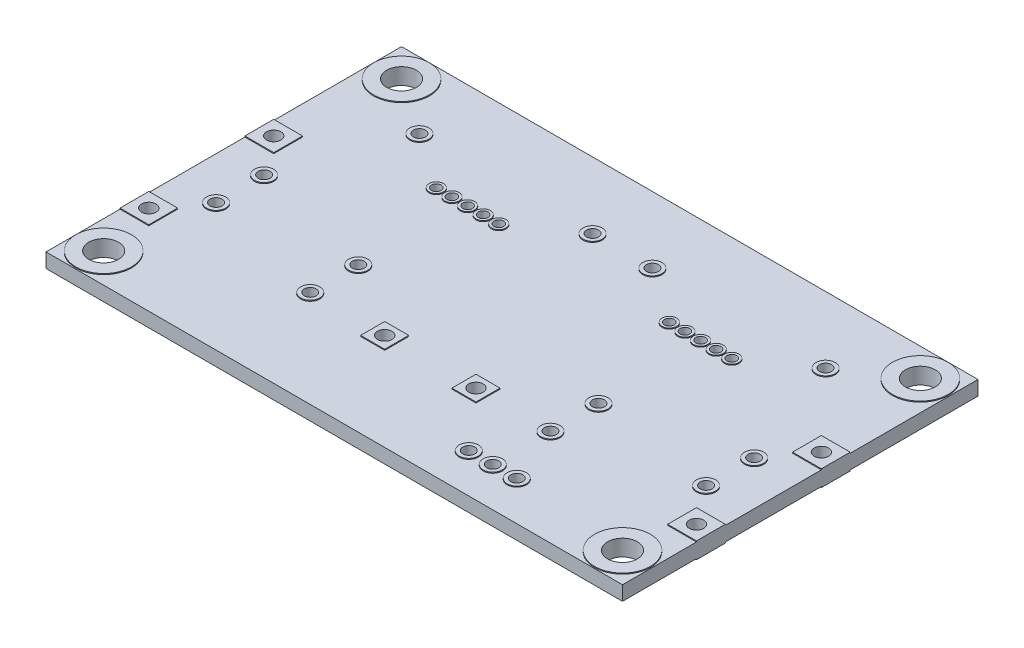
from build123d import *

# Parameters (mm, degrees)
BOSS_EXTRUDE1_DEPTH = 0.75
SKETCH2_R           = 1.5499999999999976
SKETCH2_R_2         = 0.6250000000000023
SKETCH2_R_3         = 0.6249999999999998
SKETCH2_R_4         = 0.49999999999999917
SKETCH2_R_5         = 0.5000000000000009
SKETCH2_R_6         = 0.49999999999999895
SKETCH2_R_7         = 0.750000000000002
SKETCH2_R_8         = 0.7500000000000021
SKETCH2_R_9         = 0.6249999999999986
SKETCH2_R_10        = 0.6250000000000007
SKETCH2_R_11        = 0.6250000000000004
SKETCH2_R_12        = 0.7499999999999996
CUT_EXTRUDE1_DEPTH  = 1.5
BOSS_EXTRUDE2_START = 0.1
SKETCH3_R           = 2.9
SKETCH3_R_2         = 1.5499999999999976
SKETCH3_R_3         = 0.7500000000000021
SKETCH3_R_4         = 0.49999999999999917
SKETCH3_R_5         = 0.7500000000000004
SKETCH3_R_6         = 0.5000000000000009
SKETCH3_R_7         = 0.5000000000000026
SKETCH3_R_8         = 0.49999999999999895
SKETCH3_R_9         = 1.0000000000000016
SKETCH3_R_10        = 0.6249999999999987
SKETCH3_R_11        = 1.0000000000000013
SKETCH3_R_12        = 0.6250000000000023
SKETCH3_R_13        = 1.0000000000000018
SKETCH3_R_14        = 1
SKETCH3_R_15        = 0.6250000000000007
SKETCH3_R_16        = 0.6250000000000004
SKETCH3_R_17        = 0.9999999999999996
SKETCH3_W           = 3.0000000000000107
SKETCH3_H           = 3.000000000000025
SKETCH3_H_2         = 3.0000000000000204
SKETCH3_R_18        = 0.7499999999999996
BOSS_EXTRUDE2_DEPTH = 0.1


with BuildPart() as part:
    # Sketch1 → Boss-Extrude1 (new, symmetric)
    with BuildSketch(Plane(origin=(0, 0, 0), x_dir=(1, 0, 0), z_dir=(0, 1, 0))):
        Polygon((-30, 18.499999999999996), (30, 18.499999999999996), (30.000000000000007, -18.500000000000004), (-30, -18.500000000000004), align=None)
    extrude(amount=BOSS_EXTRUDE1_DEPTH, both=True)

    # Sketch2 → Cut-Extrude1 (cut)
    with BuildSketch(Plane.XZ.offset(0.75)):
        with Locations(Location((-27.000000000000004, 15.49999999999999, 0), (0, 0, 270))):
            Circle(SKETCH2_R)
        with Locations(Location((-26.999999999999996, -15.5, 0), (0, 0, 270))):
            Circle(SKETCH2_R)
        with Locations(Location((26.999999999999996, 15.5, 0), (0, 0, 270))):
            Circle(SKETCH2_R)
        with Locations(Location((26.999999999999996, -15.5, 0), (0, 0, 270))):
            Circle(SKETCH2_R)
        with Locations(Location((21.1375, -11.499999999999996, 0), (0, 0, 270))):
            Circle(SKETCH2_R_2)
        with Locations(Location((3.1125, -11.499999999999996, 0), (0, 0, 270))):
            Circle(SKETCH2_R_3)
        with Locations(Location((-3.1125, -11.499999999999996, 0), (0, 0, 270))):
            Circle(SKETCH2_R_3)
        with Locations(Location((-21.1375, -11.499999999999996, 0), (0, 0, 270))):
            Circle(SKETCH2_R_2)
        with Locations(Location((15.375, -7.4999999999999964, 0), (0, 0, 270))):
            Circle(SKETCH2_R_4)
        with Locations(Location((8.875000000000002, -7.499999999999997, 0), (0, 0, 270))):
            Circle(SKETCH2_R_5)
        with Locations(Location((12.125, -7.499999999999997, 0), (0, 0, 270))):
            Circle(SKETCH2_R_5)
        with Locations(Location((10.5, -7.499999999999997, 0), (0, 0, 270))):
            Circle(SKETCH2_R_5)
        with Locations(Location((13.75, -7.499999999999997, 0), (0, 0, 270))):
            Circle(SKETCH2_R_5)
        with Locations(Location((-13.75, -7.499999999999997, 0), (0, 0, 90))):
            Circle(SKETCH2_R_5)
        with Locations(Location((-10.5, -7.499999999999997, 0), (0, 0, 90))):
            Circle(SKETCH2_R_5)
        with Locations(Location((-12.125, -7.499999999999997, 0), (0, 0, 90))):
            Circle(SKETCH2_R_5)
        with Locations(Location((-8.875000000000002, -7.499999999999997, 0), (0, 0, 90))):
            Circle(SKETCH2_R_5)
        with Locations(Location((-15.375, -7.4999999999999964, 0), (0, 0, 90))):
            Circle(SKETCH2_R_6)
        with Locations(Location((-28.499999999999996, -3.699999999999995, 0), (0, 0, 270))):
            Circle(SKETCH2_R_7)
        with Locations(Location((-28.499999999999996, 9.300000000000004, 0), (0, 0, 270))):
            Circle(SKETCH2_R_8)
        with Locations(Location((28.499999999999996, 9.300000000000004, 0), (0, 0, 90))):
            Circle(SKETCH2_R_8)
        with Locations(Location((28.499999999999996, -3.699999999999995, 0), (0, 0, 90))):
            Circle(SKETCH2_R_7)
        with Locations(Location((-25.5, 0.30000000000000515, 0), (0, 0, 270))):
            Circle(SKETCH2_R_9)
        with Locations(Location((-25.5, 5.300000000000005, 0), (0, 0, 270))):
            Circle(SKETCH2_R_2)
        with Locations(Location((25.5, 5.300000000000005, 0), (0, 0, 90))):
            Circle(SKETCH2_R_2)
        with Locations(Location((25.5, 0.30000000000000515, 0), (0, 0, 90))):
            Circle(SKETCH2_R_9)
        with Locations(Location((-12.5, 8.500000000000002, 0), (0, 0, 270))):
            Circle(SKETCH2_R_10)
        with Locations(Location((-12.5, 3.500000000000002, 0), (0, 0, 270))):
            Circle(SKETCH2_R_11)
        with Locations(Location((12.5, 8.500000000000002, 0), (0, 0, 90))):
            Circle(SKETCH2_R_10)
        with Locations(Location((12.5, 3.500000000000002, 0), (0, 0, 90))):
            Circle(SKETCH2_R_11)
        with Locations(Location((4.75, 8.500000000000002, 0), (0, 0, 270))):
            Circle(SKETCH2_R_12)
        with Locations(Location((-4.75, 8.500000000000002, 0), (0, 0, 270))):
            Circle(SKETCH2_R_12)
        with Locations(Location((15.000000000000007, 14.500000000000002, 0), (0, 0, 270))):
            Circle(SKETCH2_R_10)
        with Locations(Location((12.500000000000005, 14.500000000000002, 0), (0, 0, 270))):
            Circle(SKETCH2_R_10)
        with Locations(Location((10.000000000000005, 14.500000000000002, 0), (0, 0, 270))):
            Circle(SKETCH2_R_10)
    extrude(amount=-CUT_EXTRUDE1_DEPTH, mode=Mode.SUBTRACT)

    # Sketch3 → Boss-Extrude2 (add)
    # profile 1 of 35: a face of its own
    with BuildSketch(Plane.XZ.offset(0.75).offset(BOSS_EXTRUDE2_START)):
        with Locations(Location((26.999999999999996, 15.5, 0), (0, 0, 90))):
            Circle(SKETCH3_R)
        with Locations(Location((26.999999999999996, 15.5, 0), (0, 0, 270))):
            Circle(SKETCH3_R_2, mode=Mode.SUBTRACT)
    # profile 2 of 35: a face of its own
    with BuildSketch(Plane.XZ.offset(0.75).offset(BOSS_EXTRUDE2_START)):
        with Locations(Location((26.999999999999996, -15.5, 0), (0, 0, 90))):
            Circle(SKETCH3_R)
        with Locations(Location((26.999999999999996, -15.5, 0), (0, 0, 270))):
            Circle(SKETCH3_R_2, mode=Mode.SUBTRACT)
    # profile 3 of 35: a face of its own
    with BuildSketch(Plane.XZ.offset(0.75).offset(BOSS_EXTRUDE2_START)):
        with Locations(Location((-27.000000000000004, 15.49999999999999, 0), (0, 0, 90))):
            Circle(SKETCH3_R)
        with Locations(Location((-27.000000000000004, 15.49999999999999, 0), (0, 0, 270))):
            Circle(SKETCH3_R_2, mode=Mode.SUBTRACT)
    # profile 4 of 35: a face of its own
    with BuildSketch(Plane.XZ.offset(0.75).offset(BOSS_EXTRUDE2_START)):
        with Locations(Location((-26.999999999999996, -15.5, 0), (0, 0, 90))):
            Circle(SKETCH3_R)
        with Locations(Location((-26.999999999999996, -15.5, 0), (0, 0, 270))):
            Circle(SKETCH3_R_2, mode=Mode.SUBTRACT)
    # profile 5 of 35: a face of its own
    with BuildSketch(Plane.XZ.offset(0.75).offset(BOSS_EXTRUDE2_START)):
        with Locations(Location((15.375, -7.4999999999999964, 0), (0, 0, 90))):
            Circle(SKETCH3_R_3)
        with Locations(Location((15.375, -7.4999999999999964, 0), (0, 0, 270))):
            Circle(SKETCH3_R_4, mode=Mode.SUBTRACT)
    # profile 6 of 35: a face of its own
    with BuildSketch(Plane.XZ.offset(0.75).offset(BOSS_EXTRUDE2_START)):
        with Locations(Location((13.75, -7.499999999999997, 0), (0, 0, 90))):
            Circle(SKETCH3_R_5)
        with Locations(Location((13.75, -7.499999999999997, 0), (0, 0, 270))):
            Circle(SKETCH3_R_6, mode=Mode.SUBTRACT)
    # profile 7 of 35: a face of its own
    with BuildSketch(Plane.XZ.offset(0.75).offset(BOSS_EXTRUDE2_START)):
        with Locations(Location((12.125, -7.499999999999997, 0), (0, 0, 90))):
            Circle(SKETCH3_R_5)
        with Locations(Location((12.125, -7.499999999999997, 0), (0, 0, 270))):
            Circle(SKETCH3_R_6, mode=Mode.SUBTRACT)
    # profile 8 of 35: a face of its own
    with BuildSketch(Plane.XZ.offset(0.75).offset(BOSS_EXTRUDE2_START)):
        with Locations(Location((10.5, -7.499999999999997, 0), (0, 0, 90))):
            Circle(SKETCH3_R_5)
        with Locations(Location((10.5, -7.499999999999997, 0), (0, 0, 270))):
            Circle(SKETCH3_R_6, mode=Mode.SUBTRACT)
    # profile 9 of 35: a face of its own
    with BuildSketch(Plane.XZ.offset(0.75).offset(BOSS_EXTRUDE2_START)):
        with Locations(Location((8.875000000000002, -7.499999999999997, 0), (0, 0, 90))):
            Circle(SKETCH3_R_5)
        with Locations(Location((8.875000000000002, -7.499999999999997, 0), (0, 0, 270))):
            Circle(SKETCH3_R_6, mode=Mode.SUBTRACT)
    # profile 10 of 35: a face of its own
    with BuildSketch(Plane.XZ.offset(0.75).offset(BOSS_EXTRUDE2_START)):
        with Locations(Location((-8.875000000000002, -7.499999999999997, 0), (0, 0, 90))):
            Circle(SKETCH3_R_5)
        with Locations(Location((-8.875000000000002, -7.499999999999997, 0), (0, 0, 270))):
            Circle(SKETCH3_R_7, mode=Mode.SUBTRACT)
    # profile 11 of 35: a face of its own
    with BuildSketch(Plane.XZ.offset(0.75).offset(BOSS_EXTRUDE2_START)):
        with Locations(Location((-10.5, -7.499999999999997, 0), (0, 0, 90))):
            Circle(SKETCH3_R_3)
        with Locations(Location((-10.5, -7.499999999999997, 0), (0, 0, 270))):
            Circle(SKETCH3_R_6, mode=Mode.SUBTRACT)
    # profile 12 of 35: a face of its own
    with BuildSketch(Plane.XZ.offset(0.75).offset(BOSS_EXTRUDE2_START)):
        with Locations(Location((-12.125, -7.499999999999997, 0), (0, 0, 90))):
            Circle(SKETCH3_R_5)
        with Locations(Location((-12.125, -7.499999999999997, 0), (0, 0, 270))):
            Circle(SKETCH3_R_6, mode=Mode.SUBTRACT)
    # profile 13 of 35: a face of its own
    with BuildSketch(Plane.XZ.offset(0.75).offset(BOSS_EXTRUDE2_START)):
        with Locations(Location((-13.75, -7.499999999999997, 0), (0, 0, 90))):
            Circle(SKETCH3_R_3)
        with Locations(Location((-13.75, -7.499999999999997, 0), (0, 0, 270))):
            Circle(SKETCH3_R_6, mode=Mode.SUBTRACT)
    # profile 14 of 35: a face of its own
    with BuildSketch(Plane.XZ.offset(0.75).offset(BOSS_EXTRUDE2_START)):
        with Locations(Location((-15.375, -7.4999999999999964, 0), (0, 0, 90))):
            Circle(SKETCH3_R_5)
        with Locations(Location((-15.375, -7.4999999999999964, 0), (0, 0, 270))):
            Circle(SKETCH3_R_8, mode=Mode.SUBTRACT)
    # profile 15 of 35: a face of its own
    with BuildSketch(Plane.XZ.offset(0.75).offset(BOSS_EXTRUDE2_START)):
        with Locations(Location((25.5, 0.30000000000000515, 0), (0, 0, 90))):
            Circle(SKETCH3_R_9)
        with Locations(Location((25.5, 0.30000000000000515, 0), (0, 0, 270))):
            Circle(SKETCH3_R_10, mode=Mode.SUBTRACT)
    # profile 16 of 35: a face of its own
    with BuildSketch(Plane.XZ.offset(0.75).offset(BOSS_EXTRUDE2_START)):
        with Locations(Location((25.5, 5.300000000000005, 0), (0, 0, 90))):
            Circle(SKETCH3_R_11)
        with Locations(Location((25.5, 5.300000000000005, 0), (0, 0, 270))):
            Circle(SKETCH3_R_12, mode=Mode.SUBTRACT)
    # profile 17 of 35: a face of its own
    with BuildSketch(Plane.XZ.offset(0.75).offset(BOSS_EXTRUDE2_START)):
        with Locations(Location((21.1375, -11.499999999999996, 0), (0, 0, 90))):
            Circle(SKETCH3_R_13)
        with Locations(Location((21.1375, -11.499999999999996, 0), (0, 0, 270))):
            Circle(SKETCH3_R_12, mode=Mode.SUBTRACT)
    # profile 18 of 35: a face of its own
    with BuildSketch(Plane.XZ.offset(0.75).offset(BOSS_EXTRUDE2_START)):
        with Locations(Location((3.1125, -11.499999999999996, 0), (0, 0, 90))):
            Circle(SKETCH3_R_14)
        with Locations(Location((3.1125, -11.499999999999996, 0), (0, 0, 270))):
            Circle(SKETCH3_R_15, mode=Mode.SUBTRACT)
    # profile 19 of 35: a face of its own
    with BuildSketch(Plane.XZ.offset(0.75).offset(BOSS_EXTRUDE2_START)):
        with Locations(Location((-3.1125, -11.49999999999999, 0), (0, 0, 90))):
            Circle(SKETCH3_R_14)
        with Locations(Location((-3.1125, -11.49999999999999, 0), (0, 0, 90))):
            Circle(SKETCH3_R_15, mode=Mode.SUBTRACT)
    # profile 20 of 35: a face of its own
    with BuildSketch(Plane.XZ.offset(0.75).offset(BOSS_EXTRUDE2_START)):
        with Locations(Location((-21.1375, -11.500000000000002, 0), (0, 0, 90))):
            Circle(SKETCH3_R_13)
        with Locations(Location((-21.1375, -11.500000000000002, 0), (0, 0, 90))):
            Circle(SKETCH3_R_12, mode=Mode.SUBTRACT)
    # profile 21 of 35: a face of its own
    with BuildSketch(Plane.XZ.offset(0.75).offset(BOSS_EXTRUDE2_START)):
        with Locations(Location((-25.5, 5.300000000000002, 0), (0, 0, 90))):
            Circle(SKETCH3_R_11)
        with Locations(Location((-25.5, 5.300000000000002, 0), (0, 0, 90))):
            Circle(SKETCH3_R_12, mode=Mode.SUBTRACT)
    # profile 22 of 35: a face of its own
    with BuildSketch(Plane.XZ.offset(0.75).offset(BOSS_EXTRUDE2_START)):
        with Locations(Location((-25.5, 0.30000000000000493, 0), (0, 0, 90))):
            Circle(SKETCH3_R_9)
        with Locations(Location((-25.5, 0.30000000000000493, 0), (0, 0, 90))):
            Circle(SKETCH3_R_10, mode=Mode.SUBTRACT)
    # profile 23 of 35: a face of its own
    with BuildSketch(Plane.XZ.offset(0.75).offset(BOSS_EXTRUDE2_START)):
        with Locations(Location((12.5, 3.500000000000002, 0), (0, 0, 90))):
            Circle(SKETCH3_R_9)
        with Locations(Location((12.5, 3.500000000000002, 0), (0, 0, 270))):
            Circle(SKETCH3_R_16, mode=Mode.SUBTRACT)
    # profile 24 of 35: a face of its own
    with BuildSketch(Plane.XZ.offset(0.75).offset(BOSS_EXTRUDE2_START)):
        with Locations(Location((12.5, 8.500000000000002, 0), (0, 0, 90))):
            Circle(SKETCH3_R_13)
        with Locations(Location((12.5, 8.500000000000002, 0), (0, 0, 270))):
            Circle(SKETCH3_R_15, mode=Mode.SUBTRACT)
    # profile 25 of 35: a face of its own
    with BuildSketch(Plane.XZ.offset(0.75).offset(BOSS_EXTRUDE2_START)):
        with Locations(Location((-12.5, 8.499999999999995, 0), (0, 0, 90))):
            Circle(SKETCH3_R_13)
        with Locations(Location((-12.5, 8.499999999999995, 0), (0, 0, 90))):
            Circle(SKETCH3_R_15, mode=Mode.SUBTRACT)
    # profile 26 of 35: a face of its own
    with BuildSketch(Plane.XZ.offset(0.75).offset(BOSS_EXTRUDE2_START)):
        with Locations(Location((-12.5, 3.499999999999999, 0), (0, 0, 90))):
            Circle(SKETCH3_R_9)
        with Locations(Location((-12.5, 3.499999999999999, 0), (0, 0, 90))):
            Circle(SKETCH3_R_16, mode=Mode.SUBTRACT)
    # profile 27 of 35: a face of its own
    with BuildSketch(Plane.XZ.offset(0.75).offset(BOSS_EXTRUDE2_START)):
        with Locations(Location((15.000000000000007, 14.500000000000002, 0), (0, 0, 90))):
            Circle(SKETCH3_R_13)
        with Locations(Location((15.000000000000007, 14.500000000000002, 0), (0, 0, 270))):
            Circle(SKETCH3_R_15, mode=Mode.SUBTRACT)
    # profile 28 of 35: a face of its own
    with BuildSketch(Plane.XZ.offset(0.75).offset(BOSS_EXTRUDE2_START)):
        with Locations(Location((12.500000000000005, 14.500000000000002, 0), (0, 0, 90))):
            Circle(SKETCH3_R_17)
        with Locations(Location((12.500000000000005, 14.500000000000002, 0), (0, 0, 270))):
            Circle(SKETCH3_R_15, mode=Mode.SUBTRACT)
    # profile 29 of 35: a face of its own
    with BuildSketch(Plane.XZ.offset(0.75).offset(BOSS_EXTRUDE2_START)):
        with Locations(Location((10.000000000000005, 14.500000000000002, 0), (0, 0, 90))):
            Circle(SKETCH3_R_13)
        with Locations(Location((10.000000000000005, 14.500000000000002, 0), (0, 0, 270))):
            Circle(SKETCH3_R_15, mode=Mode.SUBTRACT)
    # profile 30 of 35: a face of its own
    with BuildSketch(Plane.XZ.offset(0.75).offset(BOSS_EXTRUDE2_START)):
        Polygon((30.000000000000007, -5.200000000000006), (26.999999999999996, -5.200000000000006), (26.999999999999996, -2.1999999999999837), (30.000000000000007, -2.1999999999999833), align=None)
        with Locations(Location((28.499999999999996, -3.699999999999995, 0), (0, 0, 270))):
            Circle(SKETCH3_R_3, mode=Mode.SUBTRACT)
    # profile 31 of 35: a face of its own
    with BuildSketch(Plane.XZ.offset(0.75).offset(BOSS_EXTRUDE2_START)):
        with Locations((28.5, 9.300000000000002)):
            Rectangle(SKETCH3_W, SKETCH3_H)
        with Locations(Location((28.499999999999996, 9.300000000000004, 0), (0, 0, 270))):
            Circle(SKETCH3_R_3, mode=Mode.SUBTRACT)
    # profile 32 of 35: a face of its own
    with BuildSketch(Plane.XZ.offset(0.75).offset(BOSS_EXTRUDE2_START)):
        with Locations((-28.5, 9.299999999999997)):
            Rectangle(SKETCH3_W, SKETCH3_H_2)
        with Locations(Location((-28.499999999999996, 9.299999999999997, 0), (0, 0, 90))):
            Circle(SKETCH3_R_3, mode=Mode.SUBTRACT)
    # profile 33 of 35: a face of its own
    with BuildSketch(Plane.XZ.offset(0.75).offset(BOSS_EXTRUDE2_START)):
        Polygon((-30.000000000000007, -5.200000000000003), (-26.999999999999996, -5.200000000000003), (-26.999999999999996, -2.199999999999982), (-30.000000000000007, -2.1999999999999815), align=None)
        with Locations(Location((-28.499999999999996, -3.699999999999993, 0), (0, 0, 90))):
            Circle(SKETCH3_R_3, mode=Mode.SUBTRACT)
    # profile 34 of 35: a face of its own
    with BuildSketch(Plane.XZ.offset(0.75).offset(BOSS_EXTRUDE2_START)):
        Polygon((6, 7.2500000000000036), (3.5000000000000013, 7.250000000000003), (3.5000000000000013, 9.750000000000002), (6, 9.75), align=None)
        with Locations(Location((4.75, 8.500000000000002, 0), (0, 0, 270))):
            Circle(SKETCH3_R_18, mode=Mode.SUBTRACT)
    # profile 35 of 35: a face of its own
    with BuildSketch(Plane.XZ.offset(0.75).offset(BOSS_EXTRUDE2_START)):
        Polygon((-6, 7.25), (-6, 9.749999999999993), (-3.5000000000000013, 9.749999999999995), (-3.5000000000000013, 7.249999999999999), align=None)
        with Locations(Location((-4.75, 8.499999999999995, 0), (0, 0, 90))):
            Circle(SKETCH3_R_18, mode=Mode.SUBTRACT)
    boss_extrude2 = extrude(amount=-BOSS_EXTRUDE2_DEPTH)

    # Mirror1: Boss-Extrude2 across plane
    add(boss_extrude2.mirror(Plane.ZX))


solid = part.part
